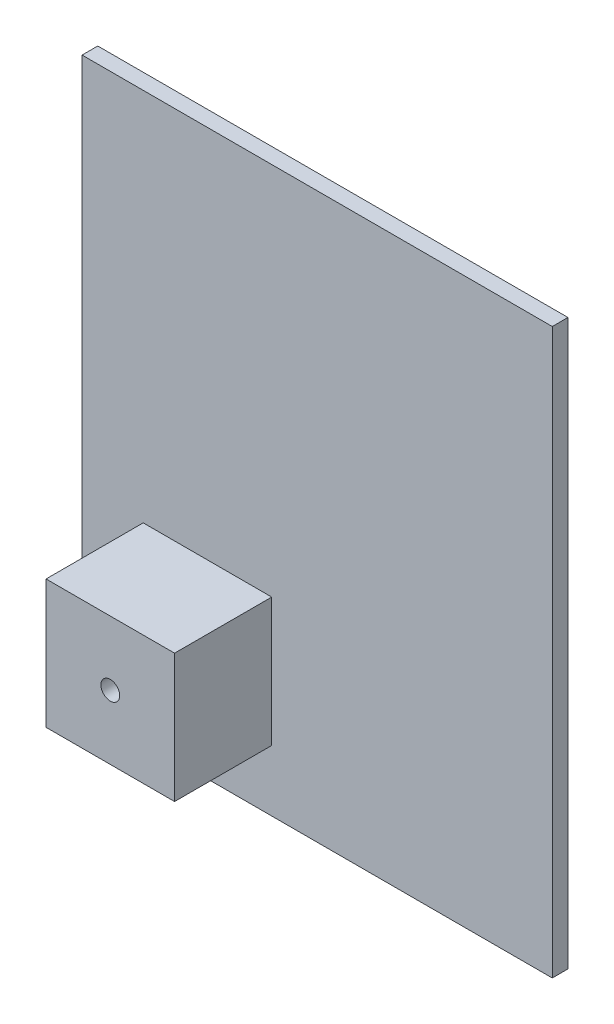
from build123d import *

# Parameters (mm, degrees)
SKETCH1_W           = 150
SKETCH1_H           = 180
SKETCH1_W_2         = 41
SKETCH1_H_2         = 41
BOSS_EXTRUDE1_DEPTH = 5
SKETCH1_3_W         = 41
SKETCH1_3_H         = 41
SKETCH1_3_R         = 3
BOSS_EXTRUDE2_DEPTH = 36
SKETCH1_4_R         = 3
BOSS_EXTRUDE3_DEPTH = 20


with BuildPart() as part:
    # Sketch1 → Boss-Extrude1 (new body)
    with BuildSketch(Plane.XY):
        Rectangle(SKETCH1_W, SKETCH1_H)
        with Locations((-35, -50)):
            Rectangle(SKETCH1_W_2, SKETCH1_H_2, mode=Mode.SUBTRACT)
    extrude(amount=BOSS_EXTRUDE1_DEPTH)

    # Sketch1<3> → Boss-Extrude2 (add)
    with BuildSketch(Plane.XY):
        with Locations((-35, -50)):
            Rectangle(SKETCH1_3_W, SKETCH1_3_H)
        with Locations((-35, -50)):
            Circle(SKETCH1_3_R, mode=Mode.SUBTRACT)
    extrude(amount=BOSS_EXTRUDE2_DEPTH)


with BuildPart() as body_2:
    # Sketch1<4> → Boss-Extrude3 (new body)
    with BuildSketch(Plane.XY):
        with Locations((-35, -50)):
            Circle(SKETCH1_4_R)
    extrude(amount=-BOSS_EXTRUDE3_DEPTH)


solid = Compound([part.part, body_2.part])
